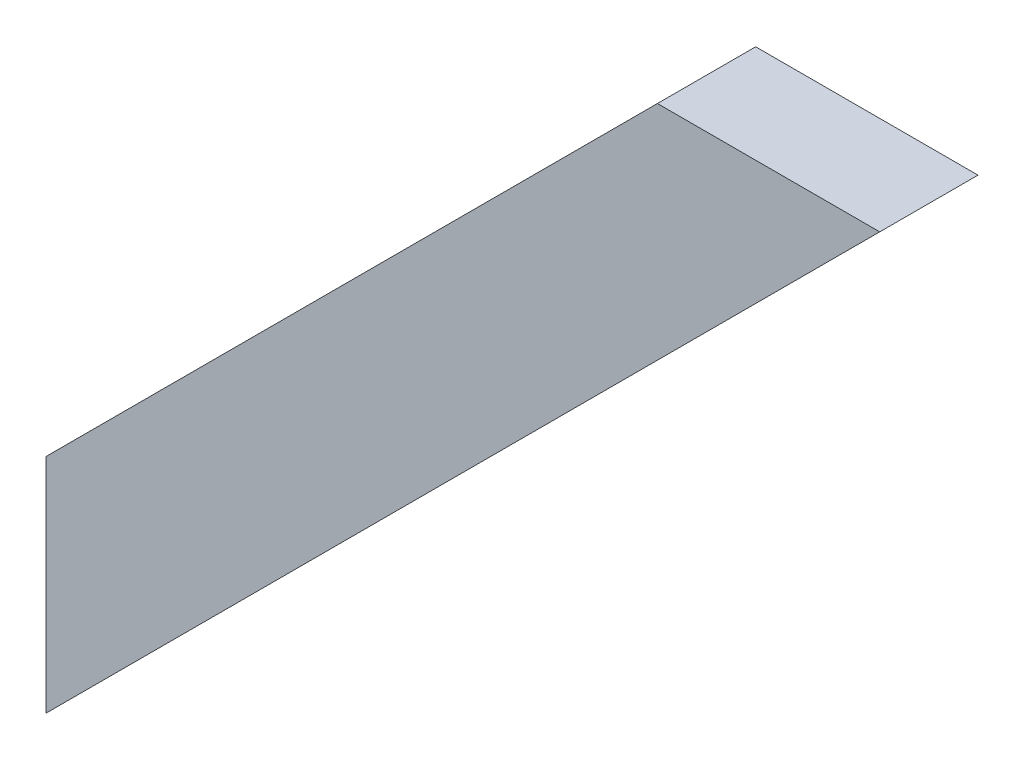
from build123d import *

# Parameters (mm, degrees)
BOSS_EXTRU_1_DEPTH = 25


with BuildPart() as part:
    # Esquisse1 → Boss.-Extru.1 (new body)
    with BuildSketch(Plane.XY):
        Polygon((0, 0), (212.132034356, 212.132034356), (155.563491861, 212.132034356), (0, 56.568542495), align=None)
    extrude(amount=BOSS_EXTRU_1_DEPTH)


solid = part.part
